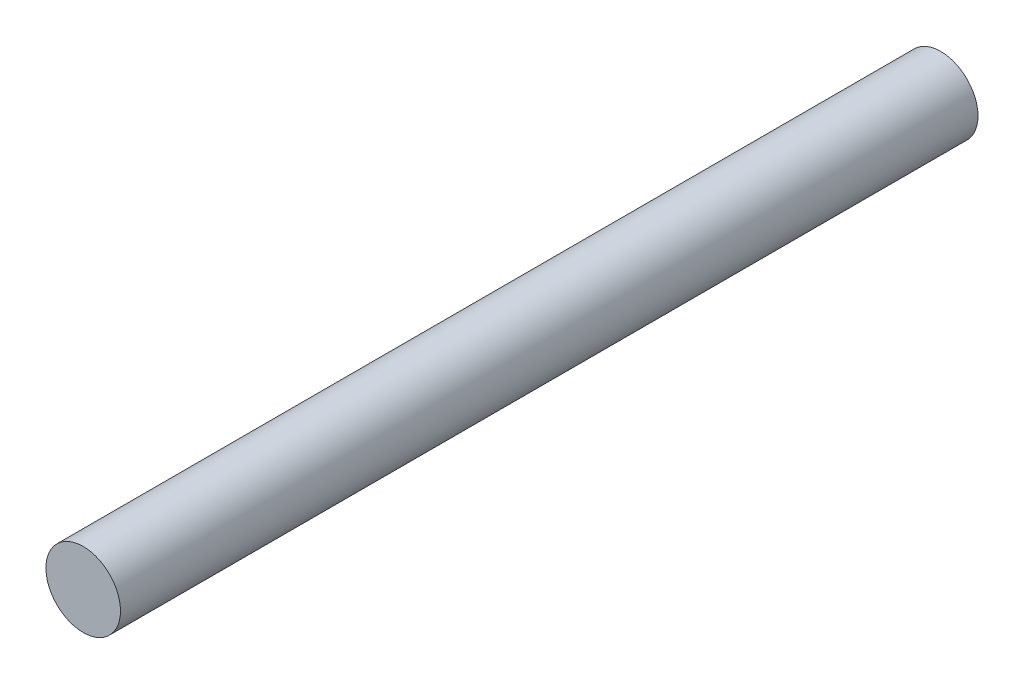
from build123d import *

# Parameters (mm, degrees)
SKETCH1_R           = 5
BOSS_EXTRUDE1_DEPTH = 115


with BuildPart() as part:
    # Sketch1 → Boss-Extrude1 (new body)
    with BuildSketch(Plane.XY):
        Circle(SKETCH1_R)
    extrude(amount=BOSS_EXTRUDE1_DEPTH)


solid = part.part
